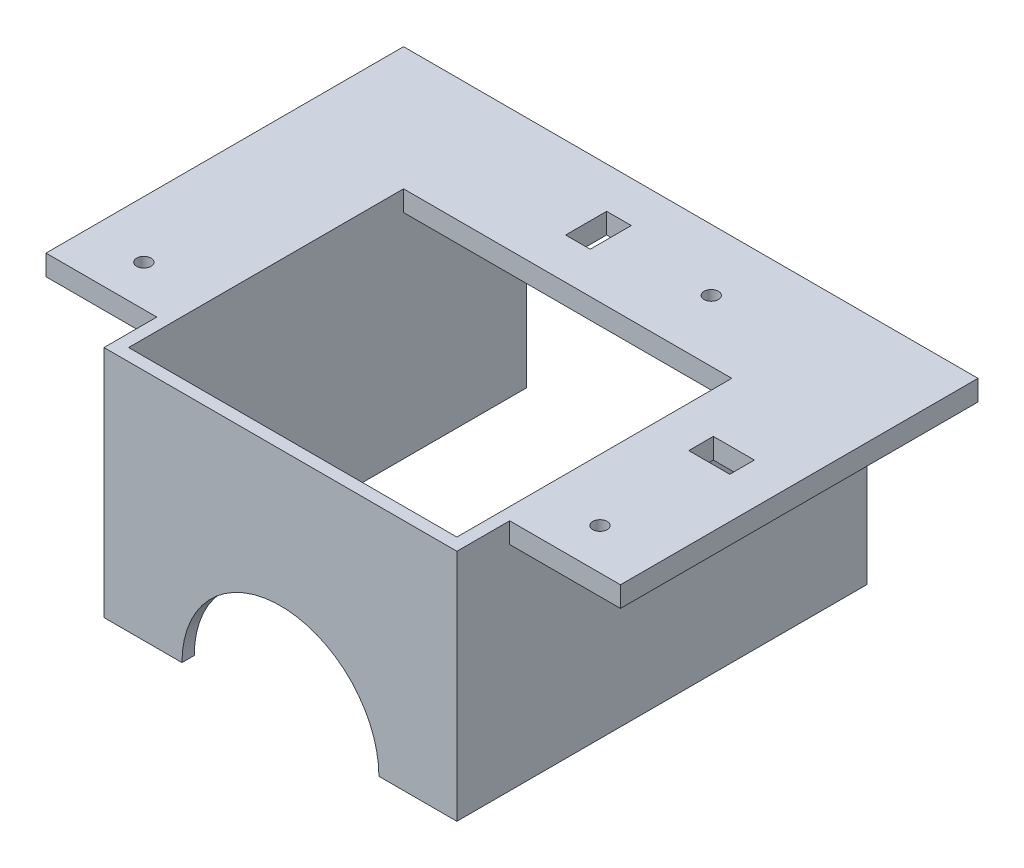
from build123d import *

# Parameters (mm, degrees)
BOSS_EXTRUDE1_DEPTH = 52
SKETCH2_W           = 30
SKETCH2_H           = 87.134992814
BOSS_EXTRUDE2_DEPTH = 5
SKETCH3_W           = 80
SKETCH3_H           = 30
BOSS_EXTRUDE3_DEPTH = 5
BOSS_EXTRUDE4_DEPTH = 5
CUT_EXTRUDE2_DEPTH  = 5
SKETCH7_R           = 1.75
CUT_EXTRUDE3_DEPTH  = 162.300960939
SKETCH8_W           = 10
SKETCH8_H           = 6
SKETCH8_W_2         = 6
SKETCH8_H_2         = 10
CUT_EXTRUDE4_DEPTH  = 162.300960939


with BuildPart() as part:
    # Sketch1 → Boss-Extrude1 (new body)
    with BuildSketch(Plane(origin=(0, 0, 0), x_dir=(1, 0, 0), z_dir=(0, 1, 0))):
        Polygon((0, 0), (0, 100), (3, 100), (3, 3), (83, 3), (83, 100), (86, 100), (86, 0), align=None)
    extrude(amount=BOSS_EXTRUDE1_DEPTH)

    # Sketch2 → Boss-Extrude2 (add)
    with BuildSketch(Plane(origin=(0, 52, 0), x_dir=(1, 0, 0), z_dir=(0, 1, 0))):
        with Locations((98, 56.432503593)):
            Rectangle(SKETCH2_W, SKETCH2_H)
        with Locations((-12, 56.432503593)):
            Rectangle(SKETCH2_W, SKETCH2_H)
    extrude(amount=BOSS_EXTRUDE2_DEPTH)

    # Sketch3 → Boss-Extrude3 (add)
    with BuildSketch(Plane(origin=(0, 57, 0), x_dir=(1, 0, 0), z_dir=(0, 1, 0))):
        with Locations((43, 85)):
            Rectangle(SKETCH3_W, SKETCH3_H)
    extrude(amount=-BOSS_EXTRUDE3_DEPTH)

    # Sketch5 → Boss-Extrude4 (add)
    with BuildSketch(Plane(origin=(0, 52, 0), x_dir=(1, 0, 0), z_dir=(0, 1, 0))):
        Polygon((0, 12.865007186), (0, 0), (86, 0), (86, 12.865007186), (83, 12.865007186), (83, 3), (3, 3), (3, 12.865007186), align=None)
    extrude(amount=BOSS_EXTRUDE4_DEPTH)

    # Sketch6 → Cut-Extrude2 (cut)
    with BuildSketch(Plane.XY):
        with BuildLine():
            Line((19, 0), (67, 0))
            ThreePointArc((67, 0), (43, 24), (19, 0))
        make_face()
    extrude(amount=-CUT_EXTRUDE2_DEPTH, mode=Mode.SUBTRACT)

    # Sketch7 → Cut-Extrude3 (cut, through all)
    with BuildSketch(Plane(origin=(0, 57, 0), x_dir=(1, 0, 0), z_dir=(0, 1, 0))):
        with Locations(Location((-13.149809764, 22.865007186, 0), (0, 0, 270))):
            Circle(SKETCH7_R)
        with Locations(Location((63, 85, 0), (0, 0, 270))):
            Circle(SKETCH7_R)
        with Locations(Location((98, 22.865007186, 0), (0, 0, 270))):
            Circle(SKETCH7_R)
    extrude(amount=-CUT_EXTRUDE3_DEPTH, mode=Mode.SUBTRACT)

    # Sketch8 → Cut-Extrude4 (cut, through all)
    with BuildSketch(Plane(origin=(0, 57, 0), x_dir=(1, 0, 0), z_dir=(0, 1, 0))):
        with Locations((98, 52.5)):
            Rectangle(SKETCH8_W, SKETCH8_H)
        with Locations((35.5, 85)):
            Rectangle(SKETCH8_W_2, SKETCH8_H_2)
    extrude(amount=-CUT_EXTRUDE4_DEPTH, mode=Mode.SUBTRACT)


solid = part.part
